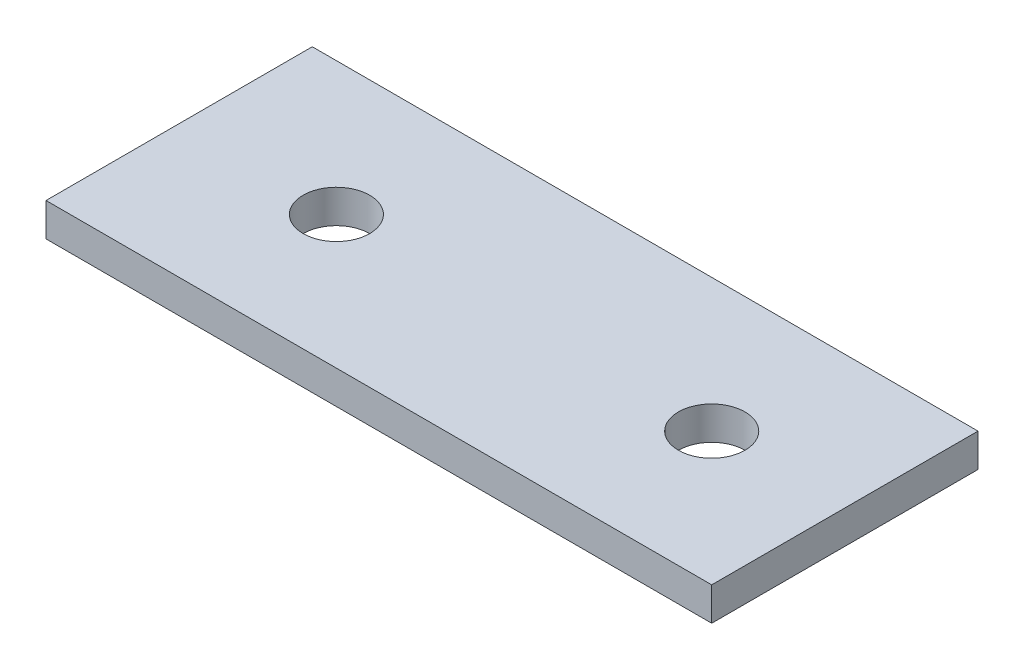
from build123d import *

# Parameters (mm, degrees)
SKETCH1_W           = 63.5
SKETCH1_H           = 25.4
BOSS_EXTRUDE1_DEPTH = 3.175
CUT_EXTRUDE1_REACH  = 36.343
SKETCH2_R           = 3.175


with BuildPart() as part:
    # Sketch1 → Boss-Extrude1 (new body)
    with BuildSketch(Plane(origin=(0, 0, 0), x_dir=(1, 0, 0), z_dir=(0, 1, 0))):
        Rectangle(SKETCH1_W, SKETCH1_H)
    extrude(amount=BOSS_EXTRUDE1_DEPTH)

    # Sketch2 → Cut-Extrude1 (cut, up to next)
    with BuildSketch(Plane(origin=(0, 3.175, 0), x_dir=(1, 0, 0), z_dir=(0, 1, 0)), mode=Mode.PRIVATE) as cut_extrude1_sk1:
        with Locations(Location((-16.75, 0, 0), (0, 0, 270))):
            Circle(SKETCH2_R)
    cut_extrude1_tool1 = extrude(cut_extrude1_sk1.sketch, amount=-CUT_EXTRUDE1_REACH, mode=Mode.PRIVATE) & part.part
    # Sketch2 → Cut-Extrude1 (cut, up to next)
    with BuildSketch(Plane(origin=(0, 3.175, 0), x_dir=(1, 0, 0), z_dir=(0, 1, 0)), mode=Mode.PRIVATE) as cut_extrude1_sk2:
        with Locations(Location((19.05, 0, 0), (0, 0, 270))):
            Circle(SKETCH2_R)
    cut_extrude1_tool2 = extrude(cut_extrude1_sk2.sketch, amount=-CUT_EXTRUDE1_REACH, mode=Mode.PRIVATE) & part.part
    add(cut_extrude1_tool1.solids().sort_by_distance((-16.75, 3.175, 0))[0], mode=Mode.SUBTRACT)
    add(cut_extrude1_tool2.solids().sort_by_distance((19.05, 3.175, 0))[0], mode=Mode.SUBTRACT)


solid = part.part
